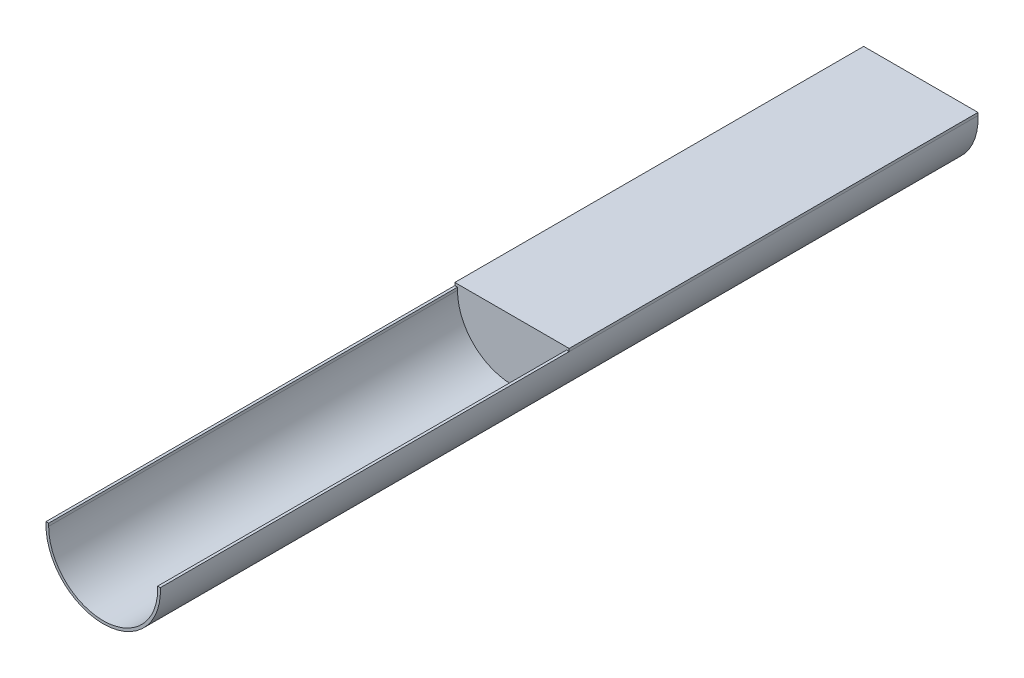
from build123d import *

# Parameters (mm, degrees)
BOSS_EXTRUDE1_DEPTH = 600
SKETCH2_W           = 83.904707854
SKETCH2_H           = 300
BOSS_EXTRUDE2_DEPTH = 2
BOSS_EXTRUDE3_START = -298
BOSS_EXTRUDE3_DEPTH = 2


with BuildPart() as part:
    # Sketch1 → Boss-Extrude1 (new body)
    with BuildSketch(Plane.XY):
        with BuildLine():
            Line((41.952353927, 2), (40, 2))
            Line((40, 2), (40, 0))
            ThreePointArc((40, 0), (0, -40), (-40, 0))
            Line((-40, 0), (-40, 2))
            Line((-40, 2), (-41.952353927, 2))
            ThreePointArc((-41.952353927, 2), (0, -42), (41.952353927, 2))
        make_face()
    extrude(amount=BOSS_EXTRUDE1_DEPTH)

    # Sketch2 → Boss-Extrude2 (add)
    with BuildSketch(Plane(origin=(0, 2, 0), x_dir=(1, 0, 0), z_dir=(0, 1, 0))):
        with Locations((0, -150)):
            Rectangle(SKETCH2_W, SKETCH2_H)
    extrude(amount=BOSS_EXTRUDE2_DEPTH)

    # Sketch3 → Boss-Extrude3 (add)
    with BuildSketch(Plane(origin=(0, 0, 0), x_dir=(-1, 0, 0), z_dir=(0, 0, -1)).offset(BOSS_EXTRUDE3_START)):
        with BuildLine():
            Line((41.952353927, 2), (-41.952353927, 2))
            ThreePointArc((-41.952353927, 2), (0, -42), (41.952353927, 2))
        make_face()
    extrude(amount=-BOSS_EXTRUDE3_DEPTH)


solid = part.part
